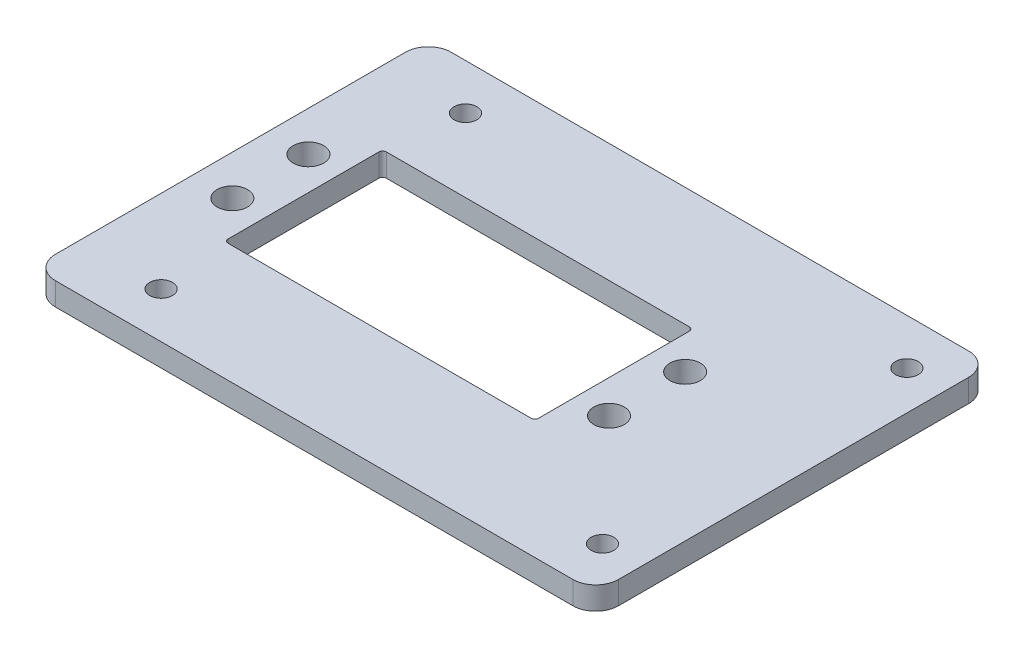
from build123d import *

# Parameters (mm, degrees)
SKETCH_1_W      = 60
SKETCH_1_H      = 52
SKETCH_1_R      = 2
SKETCH_1_R_2    = 1.5
SKETCH_1_W_2    = 40.8
SKETCH_1_H_2    = 20.8
SKETCH_1_W_3    = 14
EXTRUDE_1_DEPTH = 3
FILLET_1_R      = 0.5
FILLET_2_R      = 3


with BuildPart() as part:
    # 草图1 → 凸台-拉伸1 (new body)
    # profile 1 of 2: a face of its own
    with BuildSketch(Plane(origin=(0, 0, 0), x_dir=(1, 0, 0), z_dir=(0, 1, 0))):
        Rectangle(SKETCH_1_W, SKETCH_1_H)
        with Locations(Location((-24.75, 5, 0), (0, 0, 270))):
            Circle(SKETCH_1_R, mode=Mode.SUBTRACT)
        with Locations(Location((-24.75, -5, 0), (0, 0, 270))):
            Circle(SKETCH_1_R, mode=Mode.SUBTRACT)
        with Locations(Location((24.75, 5, 0), (0, 0, 270))):
            Circle(SKETCH_1_R, mode=Mode.SUBTRACT)
        with Locations(Location((24.75, -5, 0), (0, 0, 270))):
            Circle(SKETCH_1_R, mode=Mode.SUBTRACT)
        with Locations(Location((-19.11, 20, 0), (0, 0, 270))):
            Circle(SKETCH_1_R_2, mode=Mode.SUBTRACT)
        with Locations(Location((-19.11, -20, 0), (0, 0, 270))):
            Circle(SKETCH_1_R_2, mode=Mode.SUBTRACT)
        Rectangle(SKETCH_1_W_2, SKETCH_1_H_2, mode=Mode.SUBTRACT)
    # profile 2 of 2: a face of its own
    with BuildSketch(Plane(origin=(0, 0, 0), x_dir=(1, 0, 0), z_dir=(0, 1, 0))):
        with Locations((37, 0)):
            Rectangle(SKETCH_1_W_3, SKETCH_1_H)
        with Locations(Location((38.89, -20, 0), (0, 0, 270))):
            Circle(SKETCH_1_R_2, mode=Mode.SUBTRACT)
        with Locations(Location((38.89, 20, 0), (0, 0, 270))):
            Circle(SKETCH_1_R_2, mode=Mode.SUBTRACT)
    extrude(amount=EXTRUDE_1_DEPTH)

    # 圆角1
    fillet_1_edges = [part.edges().sort_by_distance(p)[0] for p in [
        (20.4, 1.5, -10.4),
        (-20.4, 1.5, -10.4),
        (-20.4, 1.5, 10.4),
        (20.4, 1.5, 10.4),
    ]]
    fillet(fillet_1_edges, radius=FILLET_1_R)

    # 圆角2
    fillet_2_edges = [part.edges().sort_by_distance(p)[0] for p in [
        (-30, 1.5, 26),
        (-30, 1.5, -26),
        (44, 1.5, -26),
        (44, 1.5, 26),
    ]]
    fillet(fillet_2_edges, radius=FILLET_2_R)


solid = part.part
